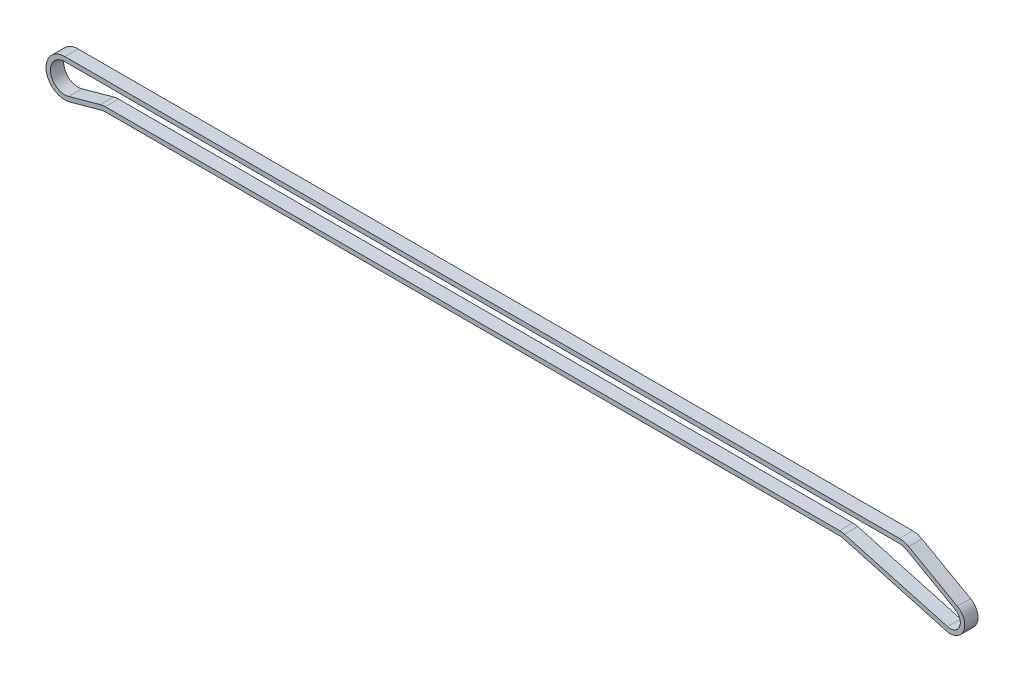
from build123d import *

# Parameters (mm, degrees)
BOSS_EXTRUDE1_DEPTH = 6


with BuildPart() as part:
    # Sketch1 → Boss-Extrude1 (new body)
    with BuildSketch(Plane.XY.offset(6)):
        with BuildLine():
            Line((-28.181092323, -10.693005494), (-13.855474963, -6.734760505))
            ThreePointArc((-13.855474963, -6.734760505), (-12.997838131, -6.55895751), (-12.124355653, -6.5))
            Line((-12.124355653, -6.5), (320, -6.5))
            ThreePointArc((320, -6.5), (320.873687158, -6.55898527), (321.731517494, -6.734870538))
            Line((321.731517494, -6.734870538), (368.327142632, -19.612679456))
            ThreePointArc((368.327142632, -19.612679456), (376.185825694, -15.769808321), (373.327054187, -7.502161528))
            Line((373.327054187, -7.502161528), (351.325657017, 4.904017546))
            ThreePointArc((351.325657017, 4.904017546), (349.308891839, 5.721439933), (347.150669091, 6))
            Line((347.150669091, 6), (-30.444863729, 6))
            ThreePointArc((-30.444863729, 6), (-38.867765447, -3.642246318), (-28.181092323, -10.693005494))
        make_face()
        with BuildLine():
            Line((350.343306916, 3.16189577), (372.344704086, -9.244283304))
            ThreePointArc((372.344704086, -9.244283304), (374.337181197, -15.006582584), (368.859917245, -17.684947314))
            Line((368.859917245, -17.684947314), (322.264292107, -4.807138396))
            ThreePointArc((322.264292107, -4.807138396), (321.142513976, -4.577134584), (320, -4.5))
            Line((320, -4.5), (-12.124355653, -4.5))
            ThreePointArc((-12.124355653, -4.5), (-13.266601971, -4.577098282), (-14.388127058, -4.806994506))
            Line((-14.388127058, -4.806994506), (-28.713744419, -8.765239495))
            ThreePointArc((-28.713744419, -8.765239495), (-36.885906219, -3.373482478), (-30.444863729, 4))
            Line((-30.444863729, 4), (347.150669091, 4))
            ThreePointArc((347.150669091, 4), (348.801074722, 3.786983478), (350.343306916, 3.16189577))
        make_face(mode=Mode.SUBTRACT)
    extrude(amount=-BOSS_EXTRUDE1_DEPTH)


solid = part.part
